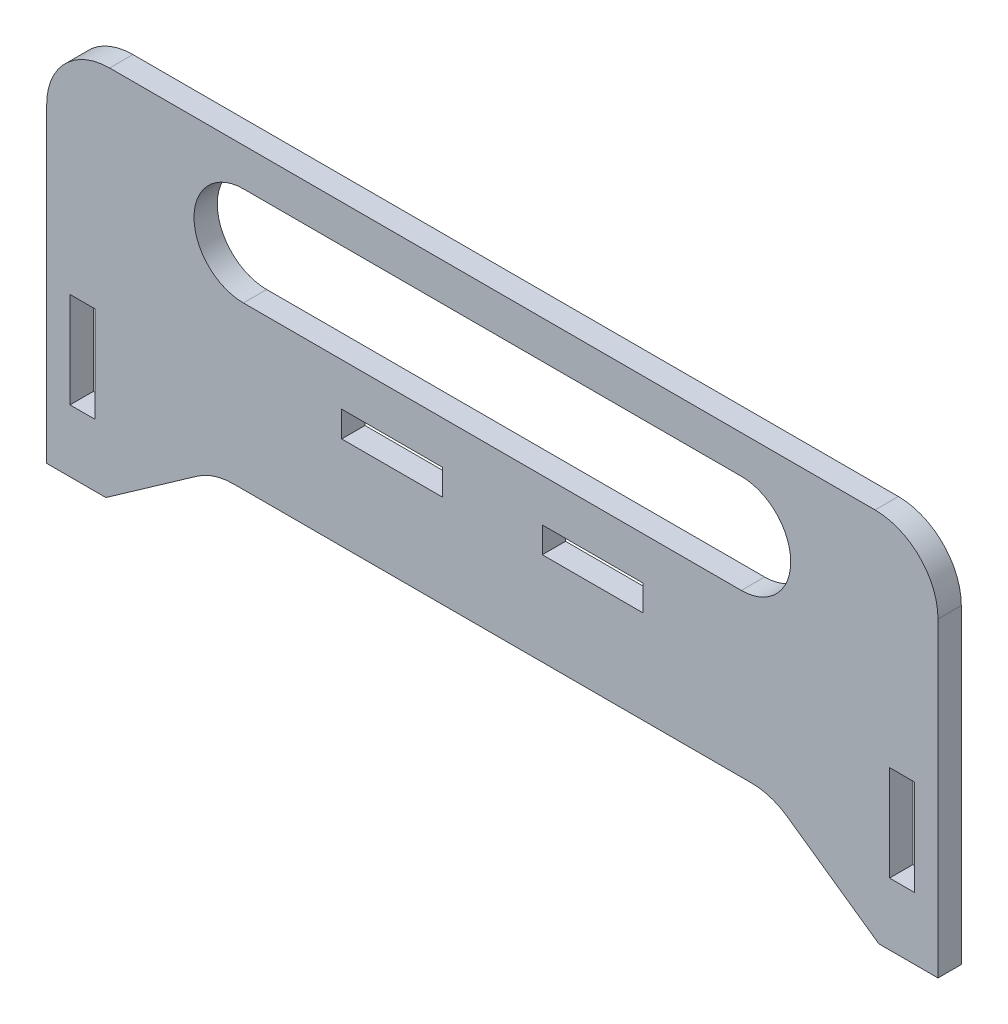
from build123d import *

# Parameters (mm, degrees)
SKETCH1_W           = 16
SKETCH1_H           = 4.1
SKETCH1_W_2         = 4
SKETCH1_H_2         = 15.2
BOSS_EXTRUDE2_DEPTH = 3.7
FILLET1_R           = 10
FILLET2_R           = 10


with BuildPart() as part:
    # Sketch1 → Boss-Extrude2 (new body)
    with BuildSketch(Plane.XY):
        Polygon((-110.178290248, 0), (31.421709752, 0), (31.421709752, -59.4), (22.021709752, -59.4), (4.921709752, -47.383344891), (-83.678290248, -47.383344891), (-100.778290248, -59.4), (-110.178290248, -59.4), align=None)
        with BuildLine():
            Line((0.171709752, -21.7), (-78.928290248, -21.7))
            ThreePointArc((-78.928290248, -21.7), (-86.778290248, -13.85), (-78.928290248, -6))
            Line((-78.928290248, -6), (0.171709752, -6))
            ThreePointArc((0.171709752, -6), (8.021709752, -13.85), (0.171709752, -21.7))
        make_face(mode=Mode.SUBTRACT)
        with Locations((-23.445790248, -30.55)):
            Rectangle(SKETCH1_W, SKETCH1_H, mode=Mode.SUBTRACT)
        with Locations((-55.310790248, -30.55)):
            Rectangle(SKETCH1_W, SKETCH1_H, mode=Mode.SUBTRACT)
        with Locations((25.721709752, -41.9)):
            Rectangle(SKETCH1_W_2, SKETCH1_H_2, mode=Mode.SUBTRACT)
        with Locations((-104.478290248, -41.9)):
            Rectangle(SKETCH1_W_2, SKETCH1_H_2, mode=Mode.SUBTRACT)
    extrude(amount=BOSS_EXTRUDE2_DEPTH)

    # Fillet1
    fillet1_edges = [part.edges().sort_by_distance(p)[0] for p in [
        (-110.178290248, 0, 1.85),
        (31.421709752, 0, 1.85),
    ]]
    fillet(fillet1_edges, radius=FILLET1_R)

    # Fillet2
    fillet2_edges = [part.edges().sort_by_distance(p)[0] for p in [
        (4.921709752, -47.383344891, 1.85),
        (-83.678290248, -47.383344891, 1.85),
    ]]
    fillet(fillet2_edges, radius=FILLET2_R)


solid = part.part
